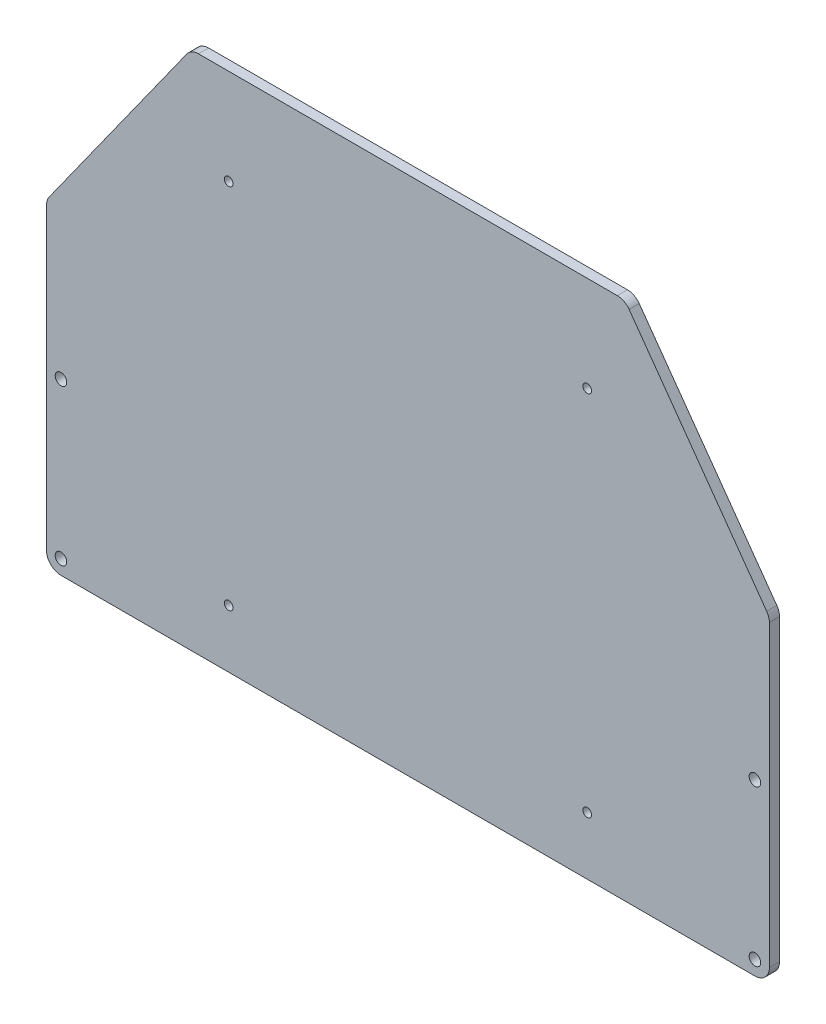
from build123d import *

# Parameters (mm, degrees)
BOSS_EXTRU_1_DEPTH           = 3.5
ESQUISSE2_R                  = 2
ENL_V_MAT_EXTRU_1_DEPTH      = 395.382111663
ENL_V_MAT_EXTRU_2_DEPTH      = 395.382111663
ENL_V_MAT_EXTRU_2_DEPTH_BACK = 395.382111663
CONG_1_R                     = 5
ESQUISSE4_R                  = 1.5
ENL_V_MAT_EXTRU_3_DEPTH      = 309.078317965


with BuildPart() as part:
    # Esquisse1 → Boss.-Extru.1 (new body)
    with BuildSketch(Plane.XY):
        with BuildLine():
            Line((5, 0), (245, 0))
            ThreePointArc((245, 0), (248.535533906, 1.464466094), (250, 5))
            Line((250, 5), (250, 305))
            Line((250, 305), (0, 305))
            Line((0, 305), (0, 5))
            ThreePointArc((0, 5), (1.464466094, 1.464466094), (5, 0))
        make_face()
    extrude(amount=BOSS_EXTRU_1_DEPTH)

    # Esquisse2 → Enlèv. mat.-Extru.1 (cut, through all)
    with BuildSketch(Plane.XY.offset(3.5)):
        with Locations((5, 5)):
            Circle(ESQUISSE2_R)
        with Locations((245, 5)):
            Circle(ESQUISSE2_R)
        with Locations((5, 58.8)):
            Circle(ESQUISSE2_R)
        with Locations((245, 58.8)):
            Circle(ESQUISSE2_R)
    extrude(amount=-ENL_V_MAT_EXTRU_1_DEPTH, mode=Mode.SUBTRACT)

    # Esquisse3 → Enlèv. mat.-Extru.2 (cut, two sides: drawn at the far end of the back side and taken through both)
    with BuildSketch(Plane.XY.offset(3.5).offset(-ENL_V_MAT_EXTRU_2_DEPTH_BACK)):
        Polygon((-374.383398967, -414.136758554), (0, 110), (50, 180), (200, 180), (250, 110), (624.383398967, -414.136758554), (624.383398967, 874.090350445), (-374.383398967, 874.090350445), align=None)
    extrude(amount=ENL_V_MAT_EXTRU_2_DEPTH + ENL_V_MAT_EXTRU_2_DEPTH_BACK, mode=Mode.SUBTRACT)

    # Congé1
    cong_1_edges = [part.edges().sort_by_distance(p)[0] for p in [
        (50, 180, 1.75),
        (200, 180, 1.75),
        (250, 110, 1.75),
        (0, 110, 1.75),
    ]]
    fillet(cong_1_edges, radius=CONG_1_R)

    # Esquisse4 → Enlèv. mat.-Extru.3 (cut, through all)
    with BuildSketch(Plane(origin=(0, 0, 0), x_dir=(-1, 0, 0), z_dir=(0, 0, -1))):
        with Locations((-187, 20)):
            Circle(ESQUISSE4_R)
        with Locations((-187, 147)):
            Circle(ESQUISSE4_R)
        with Locations((-63, 147)):
            Circle(ESQUISSE4_R)
        with Locations((-63, 20)):
            Circle(ESQUISSE4_R)
    extrude(amount=-ENL_V_MAT_EXTRU_3_DEPTH, mode=Mode.SUBTRACT)


solid = part.part
